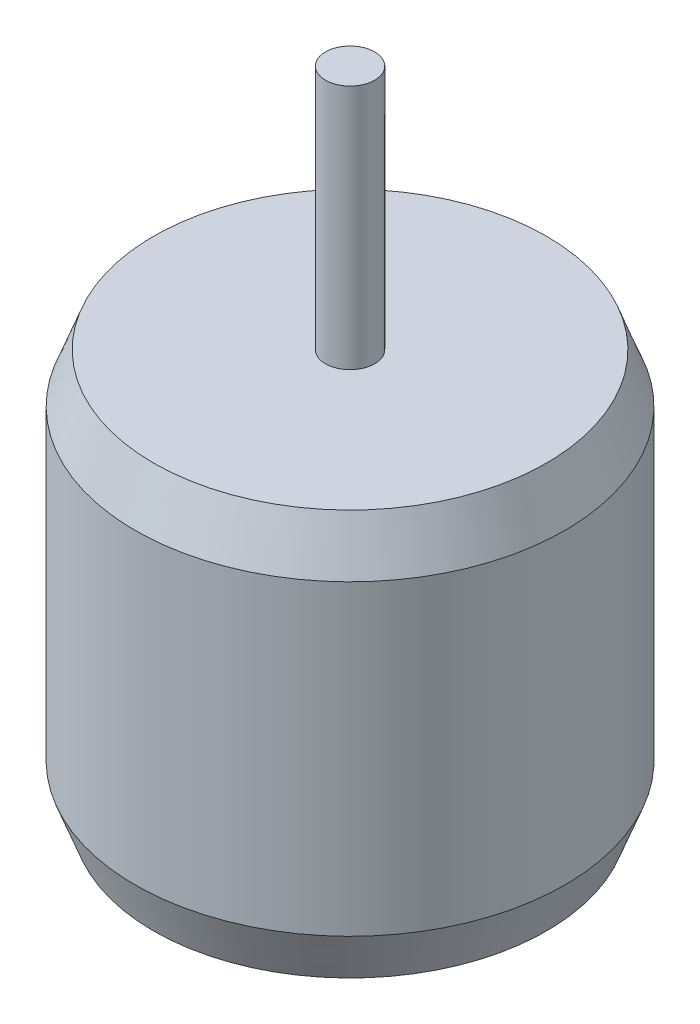
from build123d import *


with BuildPart() as part:
    # Sketch1 → Revolve1 (revolve)
    with BuildSketch(Plane(origin=(0, 0, 0), x_dir=(0, 0, -1), z_dir=(1, 0, 0)), mode=Mode.PRIVATE) as revolve1_sk:
        Polygon((0, 0), (-2, 0), (-2, -20), (-16, -20), (-17.5, -24), (-17.5, -49), (-16, -53), (-6, -53), (-6, -55), (0, -55), align=None)
    revolve(revolve1_sk.sketch.rotate(Axis((0, -55, 0), (0, 1, 0)), 180), axis=Axis((0, -55, 0), (0, 1, 0)))


solid = part.part
